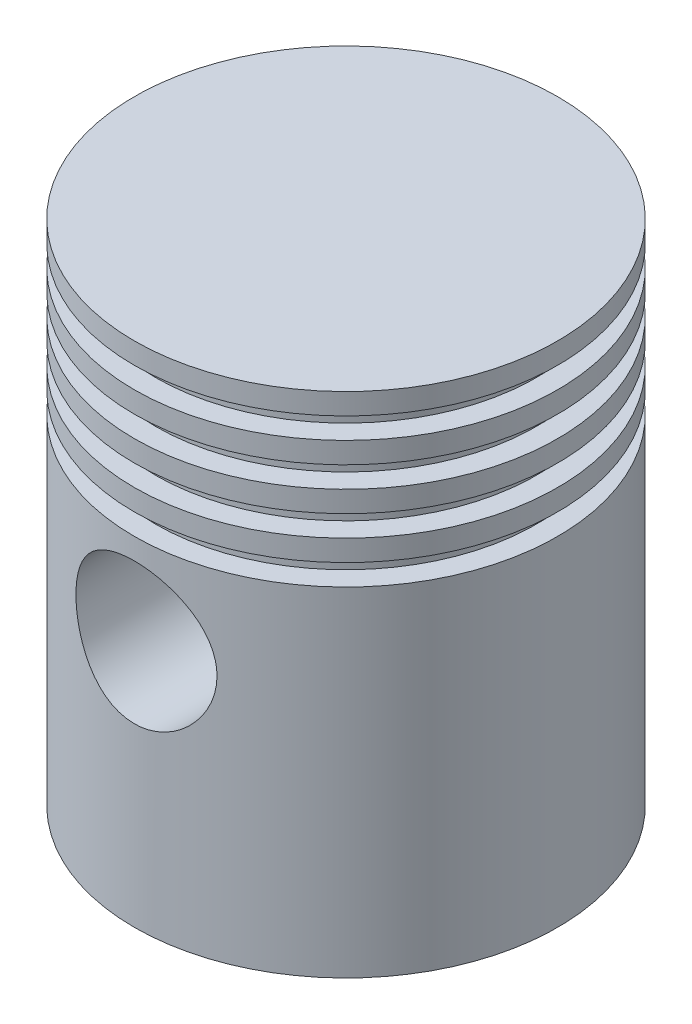
from build123d import *

# Parameters (mm, degrees)
CUT_EXTRUDE7_DEPTH      = 57.29387178
CUT_EXTRUDE7_DEPTH_BACK = 57.29387178
SKETCH7_R               = 10
CHAMFER6_SIZE           = 0.25
CHAMFER7_SIZE           = 0.25


with BuildPart() as part:
    # Sketch1 → Revolve4 (revolve)
    with BuildSketch(Plane(origin=(0, 0, 0), x_dir=(0, 0, -1), z_dir=(1, 0, 0)), mode=Mode.PRIVATE) as revolve4_sk:
        with BuildLine():
            Line((30, 37), (0, 37))
            Line((0, 37), (0, 25))
            Line((0, 25), (22, 25))
            ThreePointArc((22, 25), (23.414213562, 24.414213562), (24, 23))
            Line((24, 23), (24, 15))
            ThreePointArc((24, 15), (23.414213562, 13.585786438), (22, 13))
            Line((22, 13), (10, 13))
            Line((10, 13), (10, -13))
            Line((10, -13), (27, -13))
            Line((27, -13), (27, -32))
            Line((27, -32), (0, -32))
            Line((0, -32), (0, -35))
            Line((0, -35), (30, -35))
            Line((30, -35), (30, 13))
            Line((30, 13), (27, 13))
            Line((27, 13), (27, 16))
            Line((27, 16), (30, 16))
            Line((30, 16), (30, 19))
            Line((30, 19), (27, 19))
            Line((27, 19), (27, 22))
            Line((27, 22), (30, 22))
            Line((30, 22), (30, 25))
            Line((30, 25), (27, 25))
            Line((27, 25), (27, 28))
            Line((27, 28), (30, 28))
            Line((30, 28), (30, 31))
            Line((30, 31), (27, 31))
            Line((27, 31), (27, 34))
            Line((27, 34), (30, 34))
            Line((30, 34), (30, 37))
        make_face()
    revolve(revolve4_sk.sketch.rotate(Axis((0, 50, 0), (0, -1, 0)), 180), axis=Axis((0, 50, 0), (0, -1, 0)))

    # Sketch7 → Cut-Extrude7 (cut, two sides: drawn at the far end of the back side and taken through both)
    with BuildSketch(Plane.XY.offset(-CUT_EXTRUDE7_DEPTH_BACK)):
        Circle(SKETCH7_R)
    extrude(amount=CUT_EXTRUDE7_DEPTH + CUT_EXTRUDE7_DEPTH_BACK, mode=Mode.SUBTRACT)

    # Chamfer6
    chamfer6_edges = [part.edges().sort_by_distance(p)[0] for p in [
        (0, -32, -27),
    ]]
    chamfer(chamfer6_edges, length=CHAMFER6_SIZE)

    # Chamfer7
    chamfer7_edges = [part.edges().sort_by_distance(p)[0] for p in [
        (0, -13, -27),
    ]]
    chamfer(chamfer7_edges, length=CHAMFER7_SIZE)


solid = part.part
